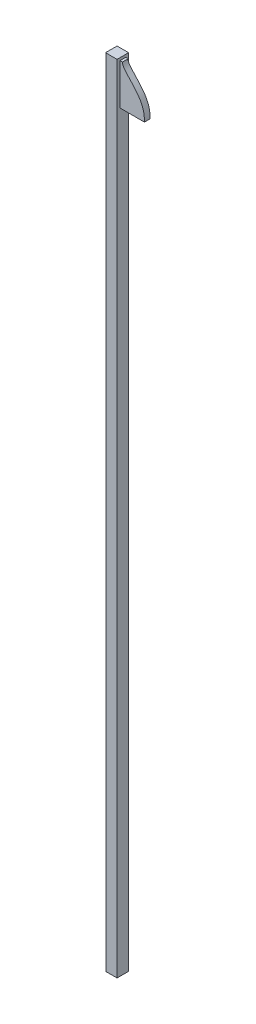
from build123d import *

# Parameters (mm, degrees)
BOSS_EXTRUDE1_DEPTH = 0.220347005
SKETCH2_W           = 0.335173503
SKETCH2_H           = 31
BOSS_EXTRUDE2_DEPTH = 0.45
SKETCH3_W           = 0.45
SKETCH3_H           = 31
BOSS_EXTRUDE3_DEPTH = 0.114826497
FILLET1_R           = 0.025


with BuildPart() as part:
    # Sketch1 → Boss-Extrude1 (new body)
    with BuildSketch(Plane(origin=(0, 0, -0.110173503), x_dir=(-1, 0, 0), z_dir=(0, 0, -1))):
        with BuildLine():
            Line((-0.100899126, 1.3), (0.85, 1.3))
            Line((0.85, 1.3), (0.85, 2.9))
            Line((0.85, 2.9), (0.754271379, 2.9))
            add(Edge.make_bspline(
                [(0.754271379, 2.9), (0.756059912, 2.890829896), (0.757688053, 2.871605997), (0.754283259, 2.84011903), (0.73796652, 2.792795969), (0.697785469, 2.724539071), (0.638294458, 2.646987167), (0.561118331, 2.56007299), (0.469917194, 2.464054427), (0.370218593, 2.359510578), (0.26840655, 2.24717531), (0.17098544, 2.127849346), (0.083811745, 2.002312001), (0.011182268, 1.871255904), (-0.044647472, 1.735241835), (-0.08270041, 1.594693954), (-0.098810181, 1.47885747), (-0.102928932, 1.390139391), (-0.102161317, 1.330181827), (-0.100899126, 1.3)],
                knots=[0, 0, 0, 0, 0, 0, 0.066666667, 0.133333333, 0.2, 0.266666667, 0.333333333, 0.4, 0.466666667, 0.533333333, 0.6, 0.666666667, 0.733333333, 0.8, 0.866666667, 0.933333333, 1, 1, 1, 1, 1, 1], degree=5))
        make_face()
    extrude(amount=-BOSS_EXTRUDE1_DEPTH)

    # Sketch2 → Boss-Extrude2 (add)
    with BuildSketch(Plane(origin=(-0.85, 0, 0), x_dir=(0, 0, -1), z_dir=(1, 0, 0))):
        with Locations((-0.057413248, -12.5)):
            Rectangle(SKETCH2_W, SKETCH2_H)
    extrude(amount=-BOSS_EXTRUDE2_DEPTH)

    # Sketch3 → Boss-Extrude3 (add)
    with BuildSketch(Plane(origin=(0, 0, -0.110173503), x_dir=(-1, 0, 0), z_dir=(0, 0, -1))):
        with Locations((1.075, -12.5)):
            Rectangle(SKETCH3_W, SKETCH3_H)
    extrude(amount=BOSS_EXTRUDE3_DEPTH)

    # Fillet1
    fillet1_edges = [part.edges().sort_by_distance(p)[0] for p in [
        (-1.3, -12.5, 0.225),
    ]]
    fillet(fillet1_edges, radius=FILLET1_R)


solid = part.part
